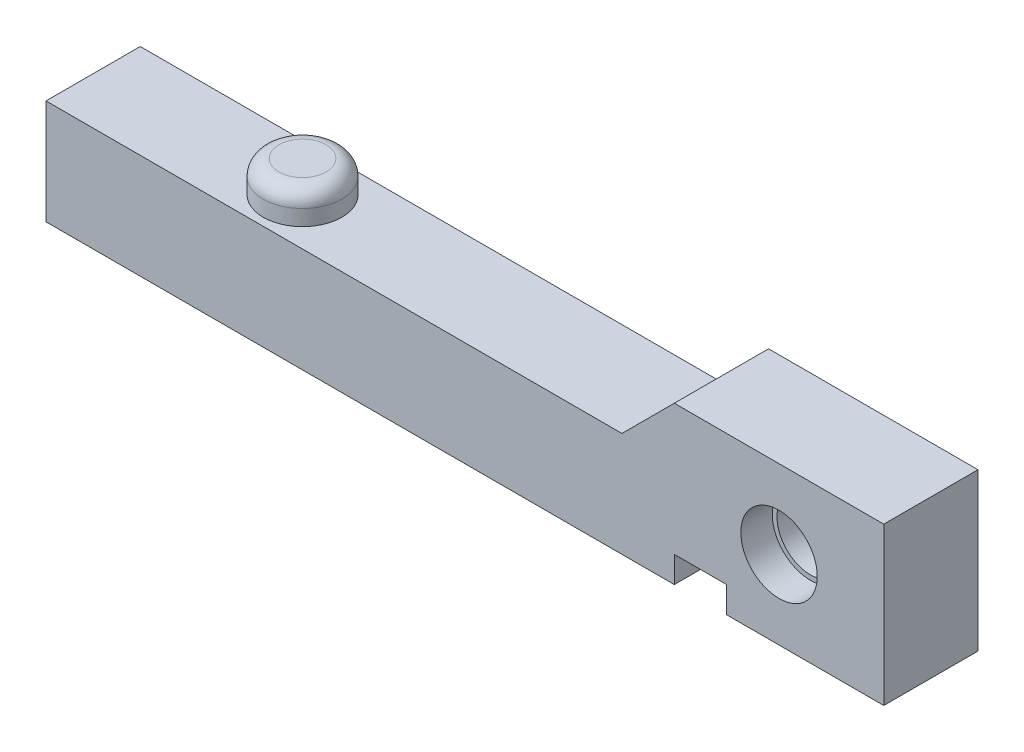
from build123d import *

# Parameters (mm, degrees)
EXTRUDE_635_DEPTH      = 4.5
EXTRUDE_635_DEPTH_BACK = 4.5
SKETCH_1_R             = 3.2
SKETCH_3_R             = 3.65
CUT_EXTRUDE_1173_DEPTH = 3
SKETCH_5_R             = 3.75
EXTRUDE_1353_DEPTH     = 3
FILLET_3_R             = 1.5


with BuildPart() as part:
    # Эскиз1 → Extrude 635 (new, two sides: drawn at the far end of the back side and taken through both)
    with BuildSketch(Plane.XY.offset(-EXTRUDE_635_DEPTH_BACK)):
        Polygon((0, 10), (55, 10), (60, 15), (80, 15), (80, 0), (65, 0), (65, 2.5), (60, 2.5), (60, 0), (13, 0), (0, 0), align=None)
        with Locations((70, 7.5)):
            Circle(SKETCH_1_R, mode=Mode.SUBTRACT)
    extrude(amount=EXTRUDE_635_DEPTH + EXTRUDE_635_DEPTH_BACK)

    # Эскиз3 → Cut-Extrude 1173 (cut)
    with BuildSketch(Plane.XY.offset(4.5)):
        with Locations((70, 7.5)):
            Circle(SKETCH_3_R)
    cut_extrude_1173 = extrude(amount=-CUT_EXTRUDE_1173_DEPTH, mode=Mode.SUBTRACT)

    # Зеркальное отражение1: Cut-Extrude 1173 across plane
    add(cut_extrude_1173.mirror(Plane.XY), mode=Mode.SUBTRACT)

    # Эскиз5 → Extrude 1353 (add)
    with BuildSketch(Plane(origin=(0, 10, 0), x_dir=(1, 0, 0), z_dir=(0, 1, 0))):
        with Locations((20, 0)):
            Circle(SKETCH_5_R)
    extrude(amount=EXTRUDE_1353_DEPTH)

    # Скругление3
    fillet_3_edges = [part.edges().sort_by_distance(p)[0] for p in [
        (16.25, 13, 0),
    ]]
    fillet(fillet_3_edges, radius=FILLET_3_R)


solid = part.part
